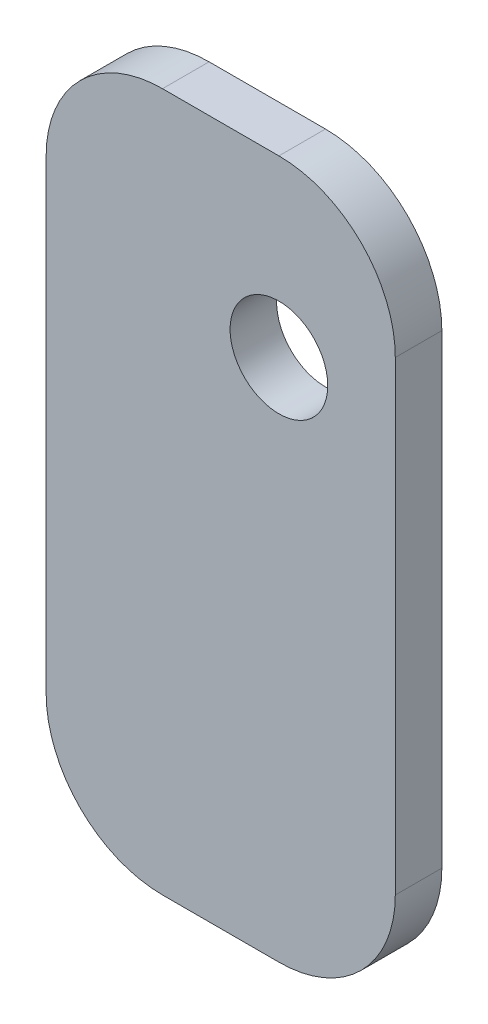
from build123d import *

# Parameters (mm, degrees)
SKETCH_2_W          = 30
SKETCH_2_H          = 60
EXTRUDE_1_DEPTH     = 4
SKETCH_3_R          = 4.195093659
CUT_EXTRUDE_1_DEPTH = 34.778691508
FILLET_1_R          = 10


with BuildPart() as part:
    # 草圖2 → 填料-伸長1 (new body)
    with BuildSketch(Plane.XY):
        Rectangle(SKETCH_2_W, SKETCH_2_H)
    extrude(amount=EXTRUDE_1_DEPTH)

    # 草圖3 → 除料-伸長1 (cut, through all)
    with BuildSketch(Plane.XY.offset(4)):
        with Locations((5, 15)):
            Circle(SKETCH_3_R)
    extrude(amount=-CUT_EXTRUDE_1_DEPTH, mode=Mode.SUBTRACT)

    # 圓角1
    fillet_1_edges = [part.edges().sort_by_distance(p)[0] for p in [
        (-15, 30, 2),
        (15, 30, 2),
        (15, -30, 2),
        (-15, -30, 2),
    ]]
    fillet(fillet_1_edges, radius=FILLET_1_R)


solid = part.part
